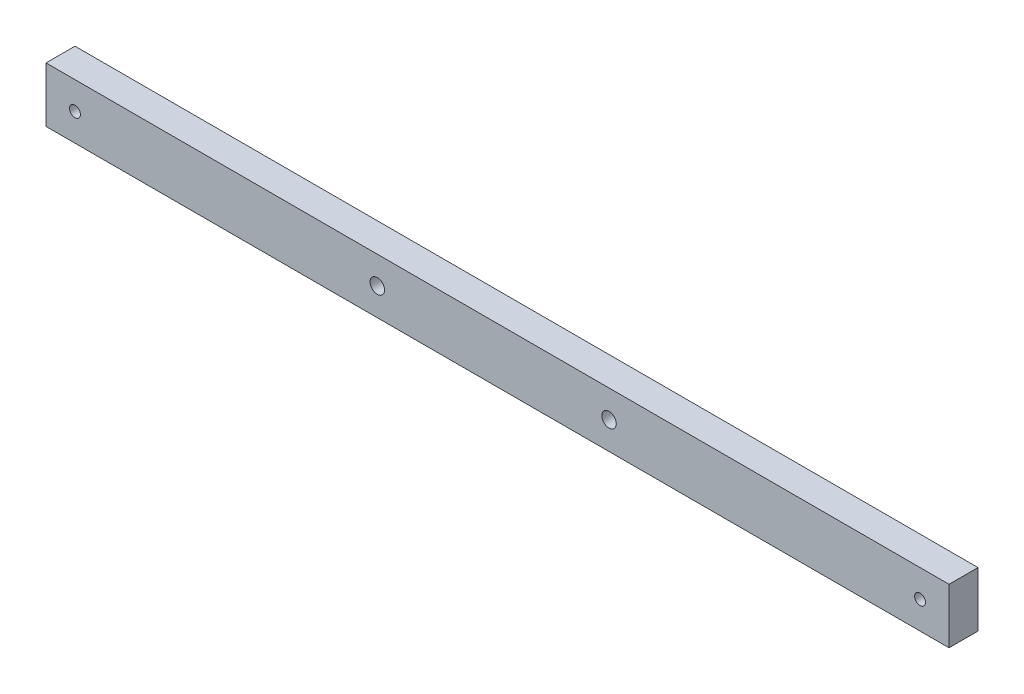
from build123d import *

# Parameters (mm, degrees)
SKETCH_2_W          = 62.35
SKETCH_2_H          = 3.8
SKETCH_2_R          = 0.5
EXTRUDE_1_DEPTH     = 2
CUT_EXTRUDE_1_REACH = 33.297
SKETCH_3_R          = 0.375


with BuildPart() as part:
    # 草图2 → 凸台-拉伸1 (new body)
    with BuildSketch(Plane.XY):
        Rectangle(SKETCH_2_W, SKETCH_2_H)
        with Locations((7.7, 0)):
            Circle(SKETCH_2_R, mode=Mode.SUBTRACT)
        with Locations((-8.3, 0)):
            Circle(SKETCH_2_R, mode=Mode.SUBTRACT)
    extrude(amount=EXTRUDE_1_DEPTH)

    # 草图3 → 切除-拉伸1 (cut, up to next)
    with BuildSketch(Plane(origin=(0, 0, 0), x_dir=(-1, 0, 0), z_dir=(0, 0, -1)), mode=Mode.PRIVATE) as cut_extrude_1_sk1:
        with Locations((29.175, 0)):
            Circle(SKETCH_3_R)
    cut_extrude_1_tool1 = extrude(cut_extrude_1_sk1.sketch, amount=-CUT_EXTRUDE_1_REACH, mode=Mode.PRIVATE) & part.part
    # 草图3 → 切除-拉伸1 (cut, up to next)
    with BuildSketch(Plane(origin=(0, 0, 0), x_dir=(-1, 0, 0), z_dir=(0, 0, -1)), mode=Mode.PRIVATE) as cut_extrude_1_sk2:
        with Locations((-29.175, 0)):
            Circle(SKETCH_3_R)
    cut_extrude_1_tool2 = extrude(cut_extrude_1_sk2.sketch, amount=-CUT_EXTRUDE_1_REACH, mode=Mode.PRIVATE) & part.part
    add(cut_extrude_1_tool1.solids().sort_by_distance((-29.175, 0, 0))[0], mode=Mode.SUBTRACT)
    add(cut_extrude_1_tool2.solids().sort_by_distance((29.175, 0, 0))[0], mode=Mode.SUBTRACT)


solid = part.part
